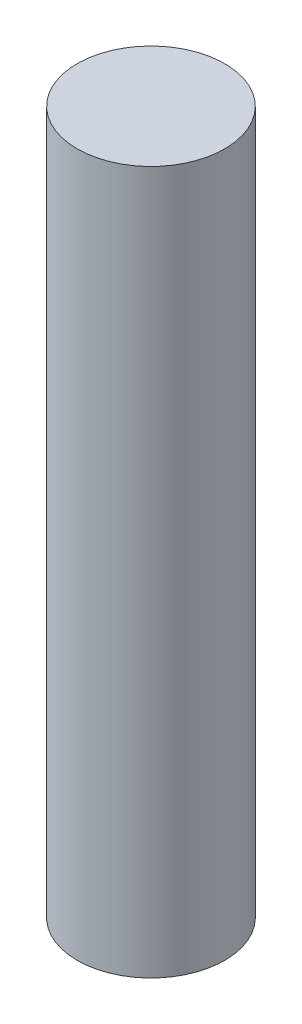
from build123d import *

# Parameters (mm, degrees)
SKETCH1_R           = 10.668
BOSS_EXTRUDE1_DEPTH = 101.6


with BuildPart() as part:
    # Sketch1 → Boss-Extrude1 (new body)
    with BuildSketch(Plane(origin=(0, 0, 0), x_dir=(1, 0, 0), z_dir=(0, 1, 0))):
        with Locations(Location((0, 0, 0), (0, 0, 270))):
            Circle(SKETCH1_R)
    extrude(amount=BOSS_EXTRUDE1_DEPTH)


solid = part.part
